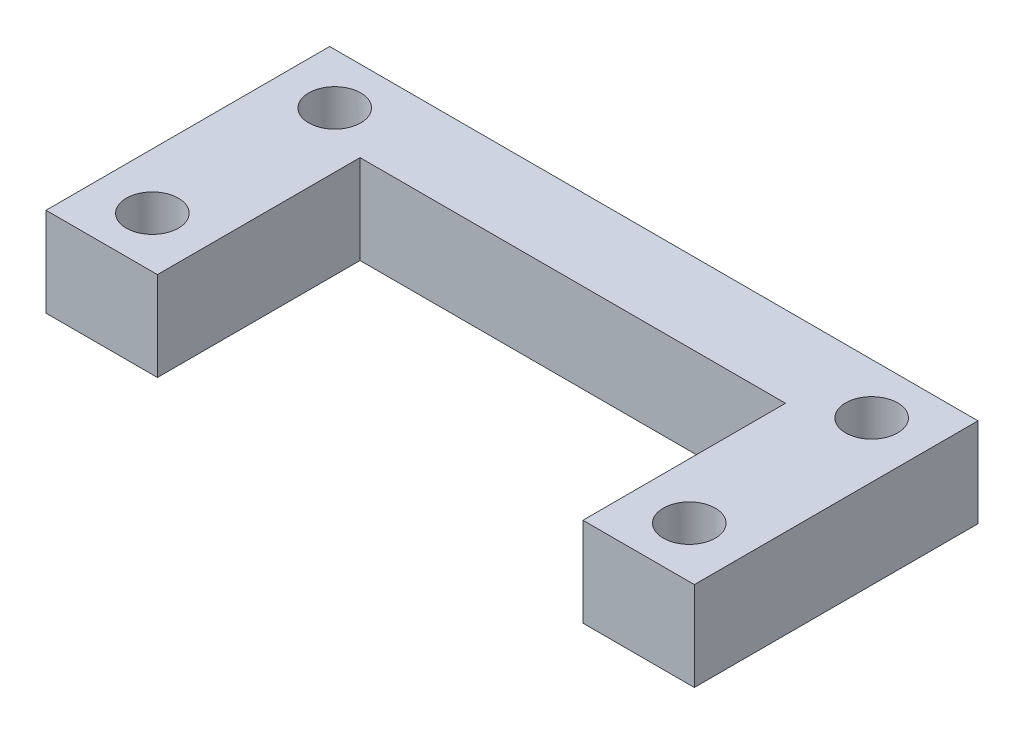
from build123d import *

# Parameters (mm, degrees)
SKETCH1_W                       = 40.64
SKETCH1_H                       = 17.78
BOSS_EXTRUDE1_DEPTH             = 29.972
SKETCH2_W                       = 26.67
SKETCH2_H                       = 29.972
CUT_EXTRUDE1_DEPTH              = 12.7
SKETCH5_R                       = 8.001
CUT_EXTRUDE4_DEPTH              = 41.340446006
SKETCH6_R                       = 1.1303
CUT_EXTRUDE5_DEPTH              = 52.802457789
SKETCH7_W                       = 19.900329636
SKETCH7_H                       = 4.576555205
BOSS_EXTRUDE2_DEPTH             = 5.08
F_5_32_0_15625_DIAMETER_HOLE1_D = 3.96875
F_30_0_1285_DIAMETER_HOLE1_D    = 3.2639
SKETCH14_W                      = 1.1303
SKETCH14_H                      = 29.972
SKETCH16_W                      = 40.64
SKETCH16_H                      = 26.629644064
CUT_EXTRUDE6_DEPTH              = 41.347520619


with BuildPart() as part:
    # Sketch1 → Boss-Extrude1 (new body)
    with BuildSketch(Plane(origin=(0, 0, 0), x_dir=(1, 0, 0), z_dir=(0, 1, 0))):
        with Locations((0, 2.667)):
            Rectangle(SKETCH1_W, SKETCH1_H)
    extrude(amount=BOSS_EXTRUDE1_DEPTH)

    # Sketch2 → Cut-Extrude1 (cut)
    with BuildSketch(Plane.XY.offset(6.223)):
        with Locations((0, 14.986)):
            Rectangle(SKETCH2_W, SKETCH2_H)
    extrude(amount=-CUT_EXTRUDE1_DEPTH, mode=Mode.SUBTRACT)

    # Sketch5 → Cut-Extrude4 (cut, through all)
    with BuildSketch(Plane(origin=(0, 0, -11.557), x_dir=(-1, 0, 0), z_dir=(0, 0, -1))):
        with Locations((0, 15.875)):
            Circle(SKETCH5_R)
    extrude(amount=-CUT_EXTRUDE4_DEPTH, mode=Mode.SUBTRACT)

    # Sketch6 → Cut-Extrude5 (cut, through all)
    with BuildSketch(Plane.ZY.offset(20.32)):
        with Locations((-2.667, 15.24)):
            Circle(SKETCH6_R)
    extrude(amount=-CUT_EXTRUDE5_DEPTH, mode=Mode.SUBTRACT)

    # Sketch7 → Boss-Extrude2 (add)
    with BuildSketch(Plane.XY.offset(-6.477)):
        with Locations((0, 27.693243708)):
            Rectangle(SKETCH7_W, SKETCH7_H)
    extrude(amount=BOSS_EXTRUDE2_DEPTH)

    # 5/32 (0.15625) Diameter Hole1 (through all)
    with Locations(Plane(origin=(0, 0, -11.557), x_dir=(-1, 0, 0), z_dir=(0, 0, -1))):
        with Locations((-10.16, 21.717), (-10.16, 10.033), (10.16, 21.717), (10.16, 10.033)):
            Hole(F_5_32_0_15625_DIAMETER_HOLE1_D / 2)

    # #30 (0.1285) Diameter Hole1 (through all)
    with Locations(Plane(origin=(0, 29.972, 0), x_dir=(-1, 0, 0), z_dir=(0, 1, 0))):
        with Locations((16.8275, 3.048), (16.8275, -8.382), (-16.8275, -8.382), (-16.8275, 3.048)):
            Hole(F_30_0_1285_DIAMETER_HOLE1_D / 2)

    # Sketch14 → #4-40 Tapped Hole1 (revolve, cut)
    with BuildSketch(Plane(origin=(0, 29.972, -3.937), x_dir=(0, 0, 1), z_dir=(1, 0, 0))):
        with Locations((0.56515, 14.986)):
            Rectangle(SKETCH14_W, SKETCH14_H)
    revolve(axis=Axis((0, 36.322, -3.937), (0, -1, 0)), mode=Mode.SUBTRACT)

    # Sketch16 → Cut-Extrude6 (cut, through all)
    with BuildSketch(Plane(origin=(0, 0, -11.557), x_dir=(-1, 0, 0), z_dir=(0, 0, -1))):
        with Locations((0, 18.902822032)):
            Rectangle(SKETCH16_W, SKETCH16_H)
    extrude(amount=-CUT_EXTRUDE6_DEPTH, mode=Mode.SUBTRACT)


solid = part.part
